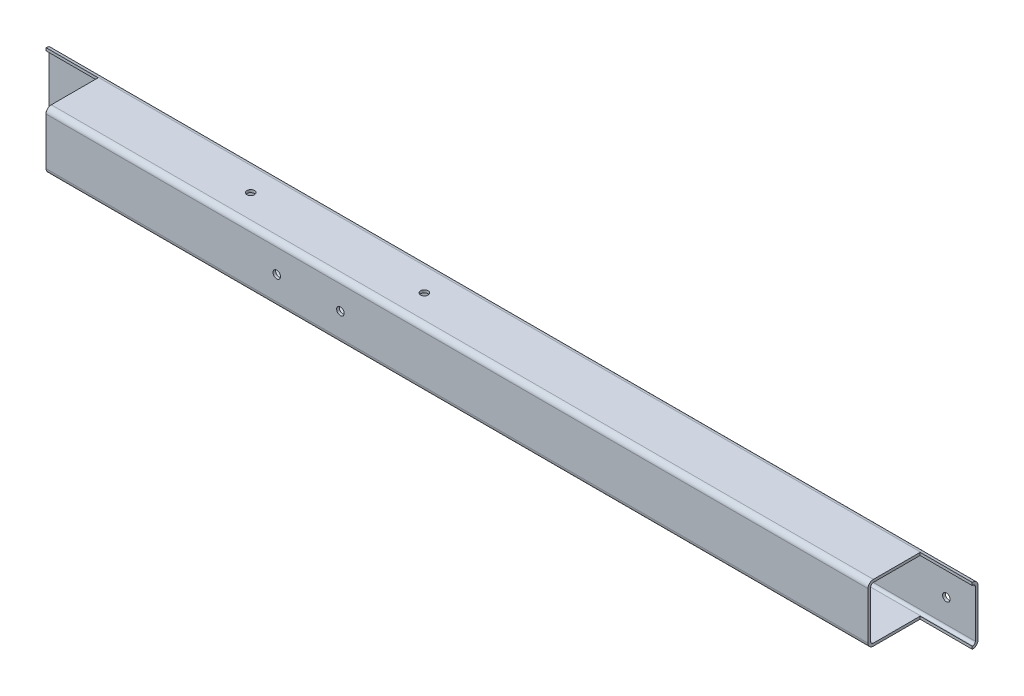
from build123d import *

# Parameters (mm, degrees)
SHS_C450_AS_50X50X2_3_SHS_C450_1_DEPTH = 800
CUT_EXTRUDE1_DEPTH                     = 402.559460105
CUT_EXTRUDE1_DEPTH_BACK                = 402.559460105
SKETCH20_W                             = 45
SKETCH20_H                             = 45
SKETCH21_R                             = 3.25
CUT_EXTRUDE2_DEPTH                     = 10
SKETCH22_R                             = 3.25
CUT_EXTRUDE3_DEPTH                     = 404.887360535
SKETCH23_R                             = 3.25
CUT_EXTRUDE4_DEPTH                     = 404.887360535


with BuildPart() as part:
    # Sketch19 → Shs c450 as 50X50X2.3 SHS C450(1) (new body)
    with BuildSketch(Plane.YZ.offset(-400)):
        with BuildLine():
            Line((-20.4, -25), (20.4, -25))
            ThreePointArc((20.4, -25), (23.652691193, -23.652691193), (25, -20.4))
            Line((25, -20.4), (25, 20.4))
            ThreePointArc((25, 20.4), (23.652691193, 23.652691193), (20.4, 25))
            Line((20.4, 25), (-20.4, 25))
            ThreePointArc((-20.4, 25), (-23.652691193, 23.652691193), (-25, 20.4))
            Line((-25, 20.4), (-25, -20.4))
            ThreePointArc((-25, -20.4), (-23.652691193, -23.652691193), (-20.4, -25))
        make_face()
        with BuildLine():
            Line((-20.4, 22.7), (20.4, 22.7))
            ThreePointArc((20.4, 22.7), (22.026345597, 22.026345597), (22.7, 20.4))
            Line((22.7, 20.4), (22.7, -20.4))
            ThreePointArc((22.7, -20.4), (22.026345597, -22.026345597), (20.4, -22.7))
            Line((20.4, -22.7), (-20.4, -22.7))
            ThreePointArc((-20.4, -22.7), (-22.026345597, -22.026345597), (-22.7, -20.4))
            Line((-22.7, -20.4), (-22.7, 20.4))
            ThreePointArc((-22.7, 20.4), (-22.026345597, 22.026345597), (-20.4, 22.7))
        make_face(mode=Mode.SUBTRACT)
    extrude(amount=SHS_C450_AS_50X50X2_3_SHS_C450_1_DEPTH)

    # Sketch20 → Cut-Extrude1 (cut, two sides: drawn at the far end of the back side and taken through both)
    with BuildSketch(Plane(origin=(0, 0, 0), x_dir=(1, 0, 0), z_dir=(0, 1, 0)).offset(-CUT_EXTRUDE1_DEPTH_BACK)):
        with Locations((-377.5, -2.5)):
            Rectangle(SKETCH20_W, SKETCH20_H)
        with Locations((377.5, -2.5)):
            Rectangle(SKETCH20_W, SKETCH20_H)
    extrude(amount=CUT_EXTRUDE1_DEPTH + CUT_EXTRUDE1_DEPTH_BACK, mode=Mode.SUBTRACT)

    # Sketch21 → Cut-Extrude2 (cut)
    with BuildSketch(Plane(origin=(0, 0, -25), x_dir=(-1, 0, 0), z_dir=(0, 0, -1))):
        with Locations((-375, 0)):
            Circle(SKETCH21_R)
        with Locations((375, 0)):
            Circle(SKETCH21_R)
    extrude(amount=-CUT_EXTRUDE2_DEPTH, mode=Mode.SUBTRACT)

    # Sketch22 → Cut-Extrude3 (cut, through all)
    with BuildSketch(Plane.XY.offset(25)):
        with Locations((-155.7, 0)):
            Circle(SKETCH22_R)
        with Locations((-100.7, 0)):
            Circle(SKETCH22_R)
    extrude(amount=-CUT_EXTRUDE3_DEPTH, mode=Mode.SUBTRACT)

    # Sketch23 → Cut-Extrude4 (cut, through all)
    with BuildSketch(Plane(origin=(0, 25, 0), x_dir=(1, 0, 0), z_dir=(0, 1, 0))):
        with Locations(Location((-203.2, 0, 0), (0, 0, 180))):
            Circle(SKETCH23_R)
        with Locations(Location((-53.2, 0, 0), (0, 0, 180))):
            Circle(SKETCH23_R)
    extrude(amount=-CUT_EXTRUDE4_DEPTH, mode=Mode.SUBTRACT)


solid = part.part
